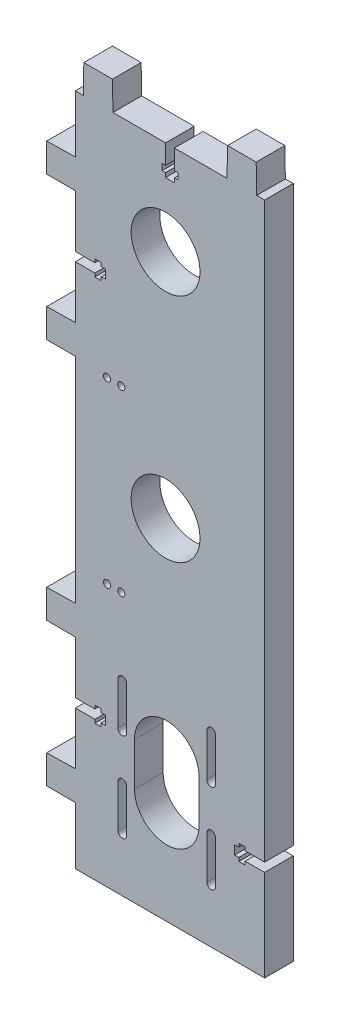
from build123d import *

# Parameters (mm, degrees)
SKETCH_1_R      = 12
SKETCH_1_R_2    = 1.25
EXTRUDE_1_DEPTH = 10


with BuildPart() as part:
    # Эскиз1 → Бобышка-Вытянуть1 (new body)
    with BuildSketch(Plane.XY):
        Polygon((-204.208503022, -30.605986098), (-138.208503022, -30.605986098), (-138.208503022, 1.294013902), (-145.008503022, 1.294013902), (-145.008503022, 0.094013902), (-147.208503022, 0.094013902), (-147.208503022, 1.294013902), (-148.708503022, 1.294013902), (-148.708503022, 4.394013902), (-147.208503022, 4.394013902), (-147.208503022, 5.594013902), (-145.008503022, 5.594013902), (-145.008503022, 4.394013902), (-138.208503022, 4.394013902), (-138.208503022, 204.394013902), (-140.975215975, 204.394013902), (-141.141859499, 214.392625303), (-151.141859499, 214.392625303), (-151.308503022, 204.394013902), (-169.658503022, 204.394013902), (-169.658503022, 197.594013902), (-168.458503022, 197.594013902), (-168.458503022, 195.394013902), (-169.658503022, 195.394013902), (-169.658503022, 193.894013902), (-172.758503022, 193.894013902), (-172.758503022, 195.394013902), (-173.958503022, 195.394013902), (-173.958503022, 197.594013902), (-172.758503022, 197.594013902), (-172.758503022, 204.394013902), (-191.108503022, 204.394013902), (-191.275146545, 214.392625303), (-201.275146545, 214.392625303), (-201.441790069, 204.394013902), (-204.208503022, 204.394013902), (-204.208503022, 184.394013902), (-214.207114422, 184.227370379), (-214.207114422, 174.227370379), (-204.208503022, 174.194013902), (-204.208503022, 155.844013902), (-197.408503022, 155.844013902), (-197.408503022, 157.044013902), (-195.208503022, 157.044013902), (-195.208503022, 155.844013902), (-193.708503022, 155.844013902), (-193.708503022, 152.744013902), (-195.208503022, 152.744013902), (-195.208503022, 151.544013902), (-197.408503022, 151.544013902), (-197.408503022, 152.744013902), (-204.208503022, 152.744013902), (-204.208503022, 134.394013902), (-214.207114422, 134.227370379), (-214.207114422, 124.227370379), (-204.208503022, 124.194013902), (-204.208503022, 49.594013902), (-214.207114422, 49.427370379), (-214.207114422, 39.427370379), (-204.208503022, 39.394013902), (-204.208503022, 21.044013902), (-197.408503022, 21.044013902), (-197.408503022, 22.244013902), (-195.208503022, 22.244013902), (-195.208503022, 21.044013902), (-193.708503022, 21.044013902), (-193.708503022, 17.944013902), (-195.208503022, 17.944013902), (-195.208503022, 16.744013902), (-197.408503022, 16.744013902), (-197.408503022, 17.944013902), (-204.208503022, 17.944013902), (-204.208503022, -0.405986098), (-214.207114422, -0.572629621), (-214.207114422, -10.572629621), (-204.208503022, -10.605986098), align=None)
        with Locations((-172.758503022, 171.470752074)):
            Circle(SKETCH_1_R, mode=Mode.SUBTRACT)
        with Locations((-172.758503022, 90.948356806)):
            Circle(SKETCH_1_R, mode=Mode.SUBTRACT)
        with Locations((-188.184986495, 60.909591185)):
            Circle(SKETCH_1_R_2, mode=Mode.SUBTRACT)
        with Locations((-193.156341495, 60.977449185)):
            Circle(SKETCH_1_R_2, mode=Mode.SUBTRACT)
        with Locations((-188.204296495, 123.199321185)):
            Circle(SKETCH_1_R_2, mode=Mode.SUBTRACT)
        with Locations((-193.175651495, 123.267179185)):
            Circle(SKETCH_1_R_2, mode=Mode.SUBTRACT)
        with BuildLine():
            Line((-186.351911088, 19.284478243), (-186.351911088, 34.284478243))
            ThreePointArc((-186.351911088, 34.284478243), (-187.851911088, 35.784478243), (-189.351911088, 34.284478243))
            Line((-189.351911088, 34.284478243), (-189.351911088, 19.284478243))
            ThreePointArc((-189.351911088, 19.284478243), (-187.851911088, 17.784478243), (-186.351911088, 19.284478243))
        make_face(mode=Mode.SUBTRACT)
        with BuildLine():
            Line((-155.351911088, 19.284478243), (-155.351911088, 34.284478243))
            ThreePointArc((-155.351911088, 34.284478243), (-156.851911088, 35.784478243), (-158.351911088, 34.284478243))
            Line((-158.351911088, 34.284478243), (-158.351911088, 19.284478243))
            ThreePointArc((-158.351911088, 19.284478243), (-156.851911088, 17.784478243), (-155.351911088, 19.284478243))
        make_face(mode=Mode.SUBTRACT)
        with BuildLine():
            Line((-155.351911088, -11.715521757), (-155.351911088, 3.284478243))
            ThreePointArc((-155.351911088, 3.284478243), (-156.851911088, 4.784478243), (-158.351911088, 3.284478243))
            Line((-158.351911088, 3.284478243), (-158.351911088, -11.715521757))
            ThreePointArc((-158.351911088, -11.715521757), (-156.851911088, -13.215521757), (-155.351911088, -11.715521757))
        make_face(mode=Mode.SUBTRACT)
        with BuildLine():
            Line((-186.351911088, -11.715521757), (-186.351911088, 3.284478243))
            ThreePointArc((-186.351911088, 3.284478243), (-187.851911088, 4.784478243), (-189.351911088, 3.284478243))
            Line((-189.351911088, 3.284478243), (-189.351911088, -11.715521757))
            ThreePointArc((-189.351911088, -11.715521757), (-187.851911088, -13.215521757), (-186.351911088, -11.715521757))
        make_face(mode=Mode.SUBTRACT)
        with BuildLine():
            Line((-183.601911088, 3.784478243), (-183.601911088, 18.784478243))
            ThreePointArc((-183.601911088, 18.784478243), (-172.351911088, 30.034478243), (-161.101911088, 18.784478243))
            Line((-161.101911088, 18.784478243), (-161.101911088, 3.784478243))
            ThreePointArc((-161.101911088, 3.784478243), (-172.351911088, -7.465521757), (-183.601911088, 3.784478243))
        make_face(mode=Mode.SUBTRACT)
    extrude(amount=EXTRUDE_1_DEPTH)


solid = part.part
